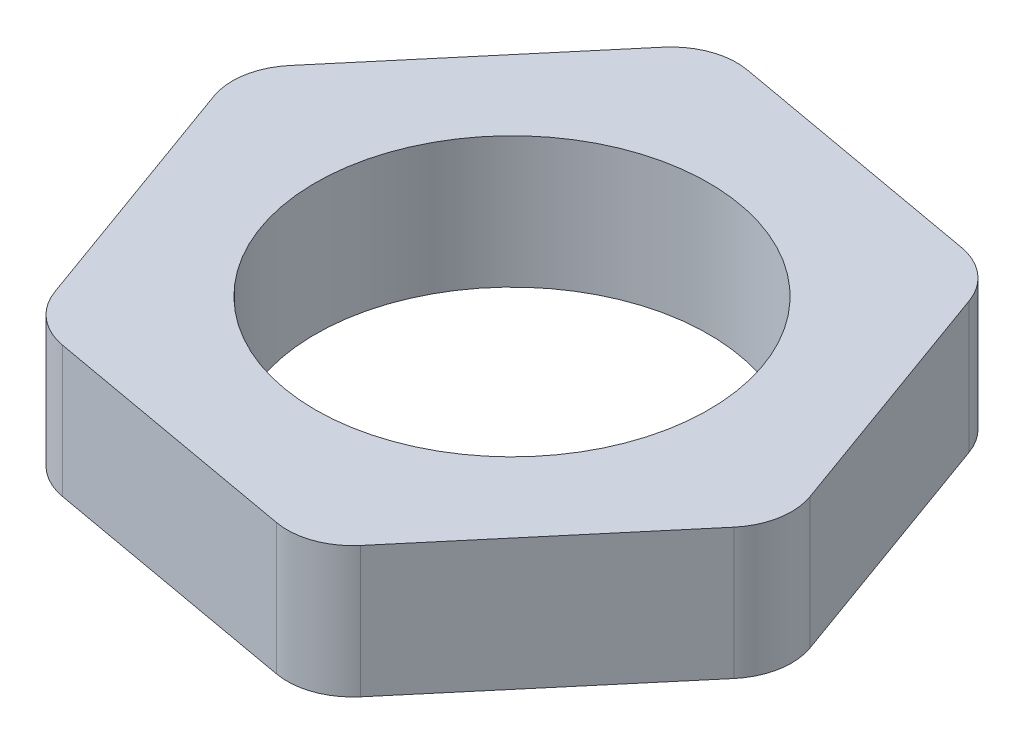
from build123d import *

# Parameters (mm, degrees)
SKETCH1_R           = 1.5
BOSS_EXTRUDE1_DEPTH = 1
FILLET1_R           = 0.5


with BuildPart() as part:
    # Sketch1 → Boss-Extrude1 (new body)
    with BuildSketch(Plane(origin=(0, 0, 0), x_dir=(1, 0, 0), z_dir=(0, 1, 0))):
        Polygon((-0.882465479, 2.443615084), (-2.557465479, 0.457570019), (-1.675, -1.986045065), (0.882465479, -2.443615084), (2.557465479, -0.457570019), (1.675, 1.986045065), align=None)
        with Locations(Location((0, 0, 0), (0, 0, 270))):
            Circle(SKETCH1_R, mode=Mode.SUBTRACT)
    extrude(amount=BOSS_EXTRUDE1_DEPTH)

    # Fillet1
    fillet1_edges = [part.edges().sort_by_distance(p)[0] for p in [
        (1.675, 0.5, -1.986045065),
        (2.557465479, 0.5, 0.457570019),
        (0.882465479, 0.5, 2.443615084),
        (-1.675, 0.5, 1.986045065),
        (-2.557465479, 0.5, -0.457570019),
        (-0.882465479, 0.5, -2.443615084),
    ]]
    fillet(fillet1_edges, radius=FILLET1_R)


solid = part.part
